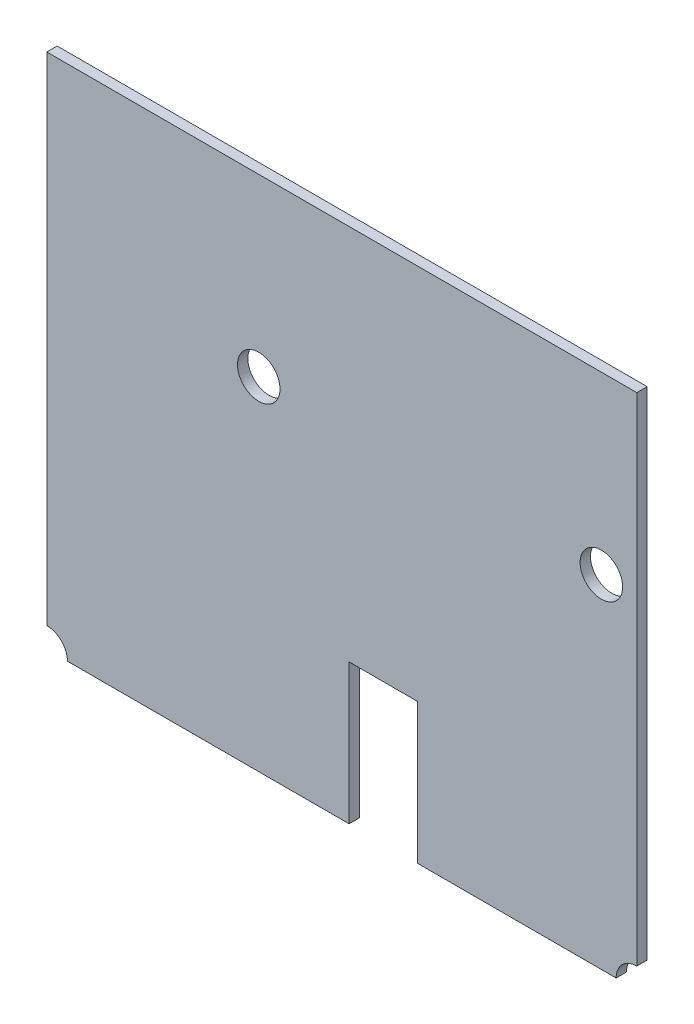
from build123d import *

# Parameters (mm, degrees)
MODEL_R         = 2.054
EXTRUDE_1_DEPTH = 1


with BuildPart() as part:
    # Model → Бобышка-Вытянуть1 (new body)
    with BuildSketch(Plane.XY):
        with BuildLine():
            Line((2635.23603, -2604.35979), (2641.85781, -2604.35979))
            Line((2641.85781, -2604.35979), (2641.85781, -2617.90434))
            Line((2641.85781, -2617.90434), (2661.0288664, -2617.90434))
            ThreePointArc((2661.0288664, -2617.90434), (2661.614235055, -2616.491135055), (2663.02744, -2615.9057664))
            Line((2663.02744, -2615.9057664), (2663.02744, -2567.94))
            Line((2663.02744, -2567.94), (2606.04, -2567.94))
            Line((2606.04, -2567.94), (2606.04, -2615.9137928))
            ThreePointArc((2606.04, -2615.9137928), (2607.447529423, -2616.496810577), (2608.0305472, -2617.90434))
            Line((2608.0305472, -2617.90434), (2635.23603, -2617.90434))
            Line((2635.23603, -2617.90434), (2635.23603, -2604.35979))
        make_face()
        with Locations((2626.50732, -2584.8749456)):
            Circle(MODEL_R, mode=Mode.SUBTRACT)
        with Locations((2659.602587949, -2584.87952199)):
            Circle(MODEL_R, mode=Mode.SUBTRACT)
    extrude(amount=EXTRUDE_1_DEPTH)


solid = part.part
